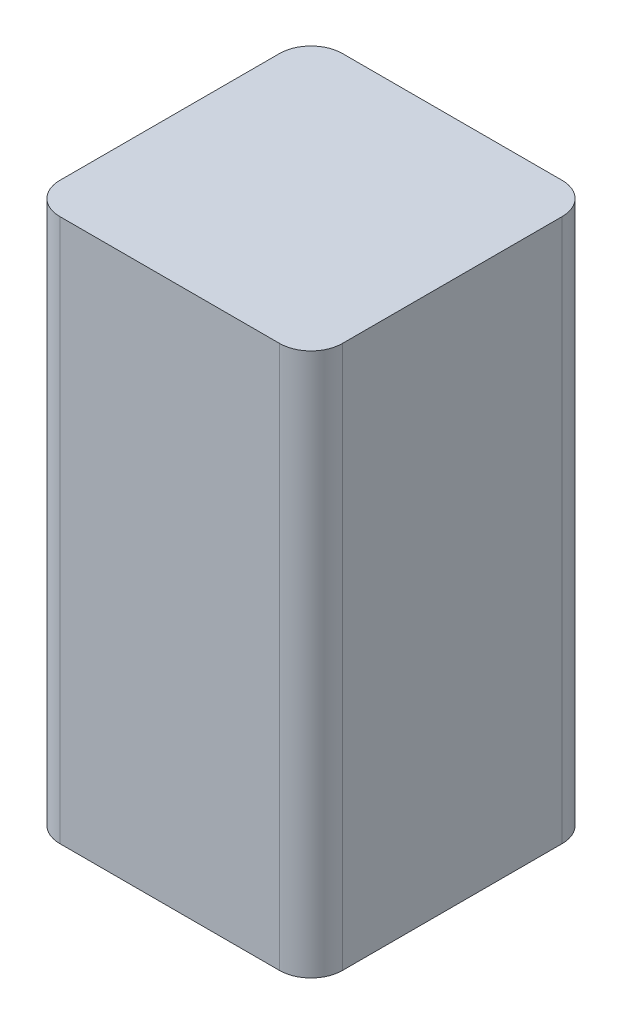
from build123d import *

# Parameters (mm, degrees)
CROQUIS1_W              = 90
CROQUIS1_H              = 90
SALIENTE_EXTRUIR1_DEPTH = 173
REDONDEO1_R             = 10


with BuildPart() as part:
    # Croquis1 → Saliente-Extruir1 (new body)
    with BuildSketch(Plane(origin=(0, 0, 0), x_dir=(1, 0, 0), z_dir=(0, 1, 0))):
        Rectangle(CROQUIS1_W, CROQUIS1_H)
    extrude(amount=SALIENTE_EXTRUIR1_DEPTH)

    # Redondeo1
    redondeo1_edges = [part.edges().sort_by_distance(p)[0] for p in [
        (-45, 86.5, -45),
        (45, 86.5, -45),
        (45, 86.5, 45),
        (-45, 86.5, 45),
    ]]
    fillet(redondeo1_edges, radius=REDONDEO1_R)


solid = part.part
